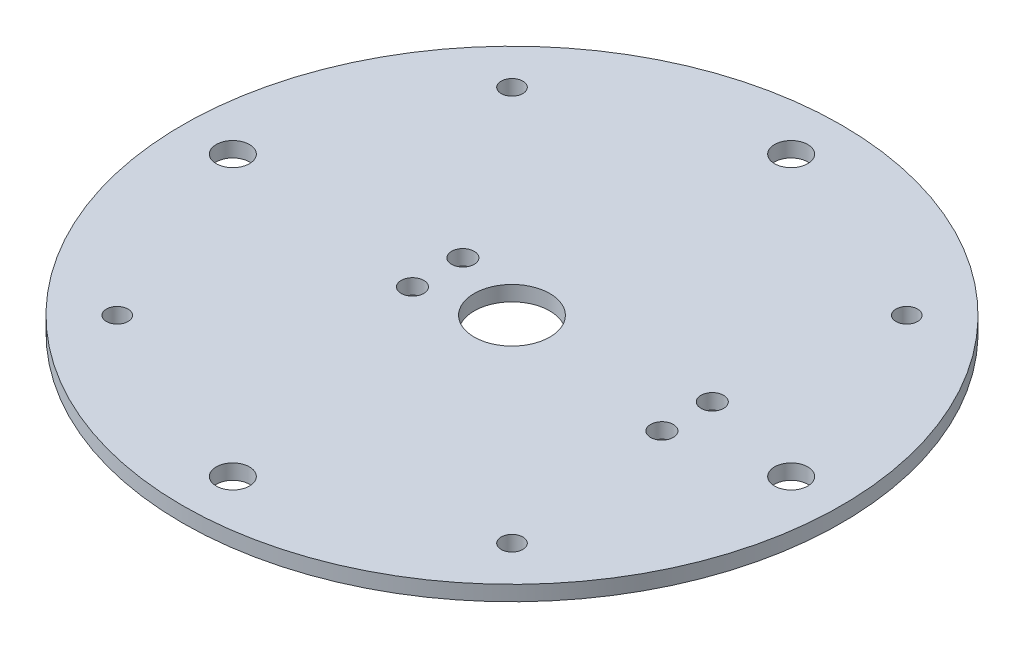
from build123d import *

# Parameters (mm, degrees)
SKETCH1_R            = 65.4
BOSS_EXTRUDE1_DEPTH  = 1.5
M6_CLEARANCE_HOLE1_D = 6.6
CIRPATTERN2_COUNT    = 4
M4_CLEARANCE_HOLE1_D = 4.3
CIRPATTERN1_COUNT    = 4
SKETCH10_R           = 7.5
CUT_EXTRUDE1_DEPTH   = 93.538208325
SKETCH11_R           = 2.25
CUT_EXTRUDE2_DEPTH   = 93.538208325


with BuildPart() as part:
    # Sketch1 → Boss-Extrude1 (new, symmetric)
    with BuildSketch(Plane(origin=(0, 0, 0), x_dir=(1, 0, 0), z_dir=(0, 1, 0))):
        with Locations(Location((0, 0, 0), (0, 0, 270))):
            Circle(SKETCH1_R)
    extrude(amount=BOSS_EXTRUDE1_DEPTH, both=True)

    # M6 Clearance Hole1 (through all)
    with Locations(Plane(origin=(0, 1.5, 0), x_dir=(1, 0, 0), z_dir=(0, 1, 0))):
        with Locations((55.4, 0)):
            m6_clearance_hole1 = Hole(M6_CLEARANCE_HOLE1_D / 2)

    # CirPattern2: M6 Clearance Hole1 ×4 about axis
    cirpattern2_axis = Axis((0, 0, 0), (0, 1, 0))
    for i in range(1, CIRPATTERN2_COUNT):
        add(m6_clearance_hole1.rotate(cirpattern2_axis, i * 360 / CIRPATTERN2_COUNT), mode=Mode.SUBTRACT)

    # M4 Clearance Hole1 (through all)
    with Locations(Plane(origin=(0, 1.5, 0), x_dir=(1, 0, 0), z_dir=(0, 1, 0))):
        with Locations((39.173715678, 39.173715678)):
            m4_clearance_hole1 = Hole(M4_CLEARANCE_HOLE1_D / 2)

    # CirPattern1: M4 Clearance Hole1 ×4 about axis
    cirpattern1_axis = Axis((0, 0, 0), (0, 1, 0))
    for i in range(1, CIRPATTERN1_COUNT):
        add(m4_clearance_hole1.rotate(cirpattern1_axis, i * 360 / CIRPATTERN1_COUNT), mode=Mode.SUBTRACT)

    # Sketch10 → Cut-Extrude1 (cut, through all)
    with BuildSketch(Plane(origin=(0, 1.5, 0), x_dir=(1, 0, 0), z_dir=(0, 1, 0))):
        with Locations(Location((0, 0, 0), (0, 0, 270))):
            Circle(SKETCH10_R)
    extrude(amount=-CUT_EXTRUDE1_DEPTH, mode=Mode.SUBTRACT)

    # Sketch11 → Cut-Extrude2 (cut, through all)
    with BuildSketch(Plane.XZ.offset(1.5)):
        with Locations(Location((-14.75, -5, 0), (0, 0, 270))):
            Circle(SKETCH11_R)
        with Locations(Location((-14.75, 5, 0), (0, 0, 270))):
            Circle(SKETCH11_R)
        with Locations(Location((34.75, -5, 0), (0, 0, 270))):
            Circle(SKETCH11_R)
        with Locations(Location((34.75, 5, 0), (0, 0, 270))):
            Circle(SKETCH11_R)
    extrude(amount=-CUT_EXTRUDE2_DEPTH, mode=Mode.SUBTRACT)


solid = part.part
